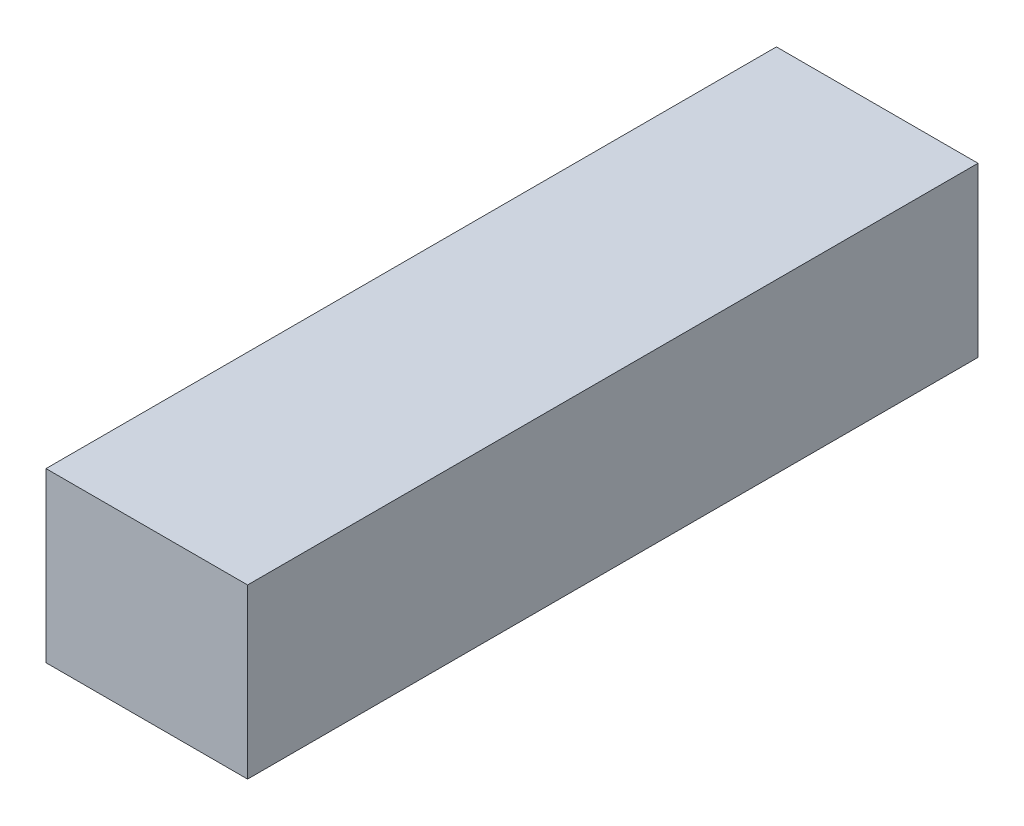
from build123d import *

# Parameters (mm, degrees)
SKETCH1_W           = 30.45
SKETCH1_H           = 110.33
BOSS_EXTRUDE1_DEPTH = 25.4


with BuildPart() as part:
    # Sketch1 → Boss-Extrude1 (new body)
    with BuildSketch(Plane(origin=(0, 0, 0), x_dir=(1, 0, 0), z_dir=(0, 1, 0))):
        Rectangle(SKETCH1_W, SKETCH1_H)
    extrude(amount=BOSS_EXTRUDE1_DEPTH)


solid = part.part
